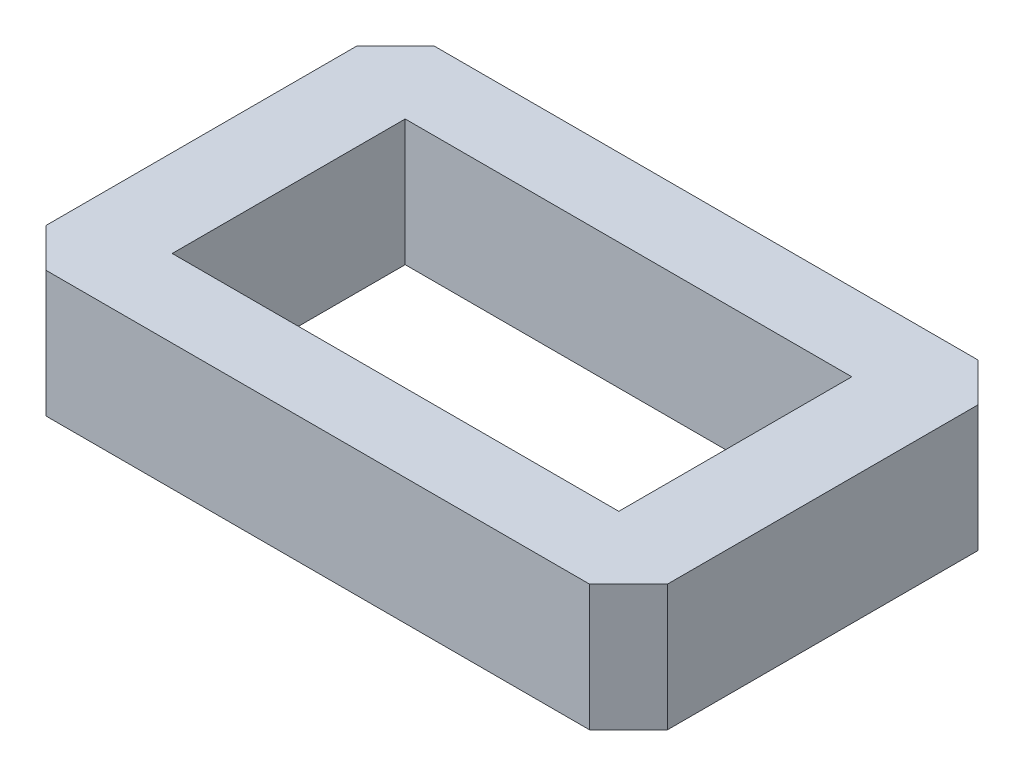
from build123d import *

# Parameters (mm, degrees)
SKETCH1_W           = 32
SKETCH1_H           = 20
BOSS_EXTRUDE1_DEPTH = 6.5
SKETCH2_W           = 11.5
SKETCH2_H           = 12
CUT_EXTRUDE1_DEPTH  = 39.291643997
CHAMFER1_SIZE       = 2


with BuildPart() as part:
    # Sketch1 → Boss-Extrude1 (new body)
    with BuildSketch(Plane(origin=(0, 0, 0), x_dir=(1, 0, 0), z_dir=(0, 1, 0))):
        with Locations((16, 10)):
            Rectangle(SKETCH1_W, SKETCH1_H)
    extrude(amount=BOSS_EXTRUDE1_DEPTH)

    # Sketch2 → Cut-Extrude1 (cut, through all)
    with BuildSketch(Plane(origin=(0, 6.5, 0), x_dir=(1, 0, 0), z_dir=(0, 1, 0))):
        with Locations((10.25, 10)):
            Rectangle(SKETCH2_W, SKETCH2_H)
        with Locations((21.75, 10)):
            Rectangle(SKETCH2_W, SKETCH2_H)
    extrude(amount=-CUT_EXTRUDE1_DEPTH, mode=Mode.SUBTRACT)

    # Chamfer1
    chamfer1_edges = [part.edges().sort_by_distance(p)[0] for p in [
        (0, 3.25, -20),
        (32, 3.25, -20),
        (32, 3.25, 0),
        (0, 3.25, 0),
    ]]
    chamfer(chamfer1_edges, length=CHAMFER1_SIZE)


solid = part.part
